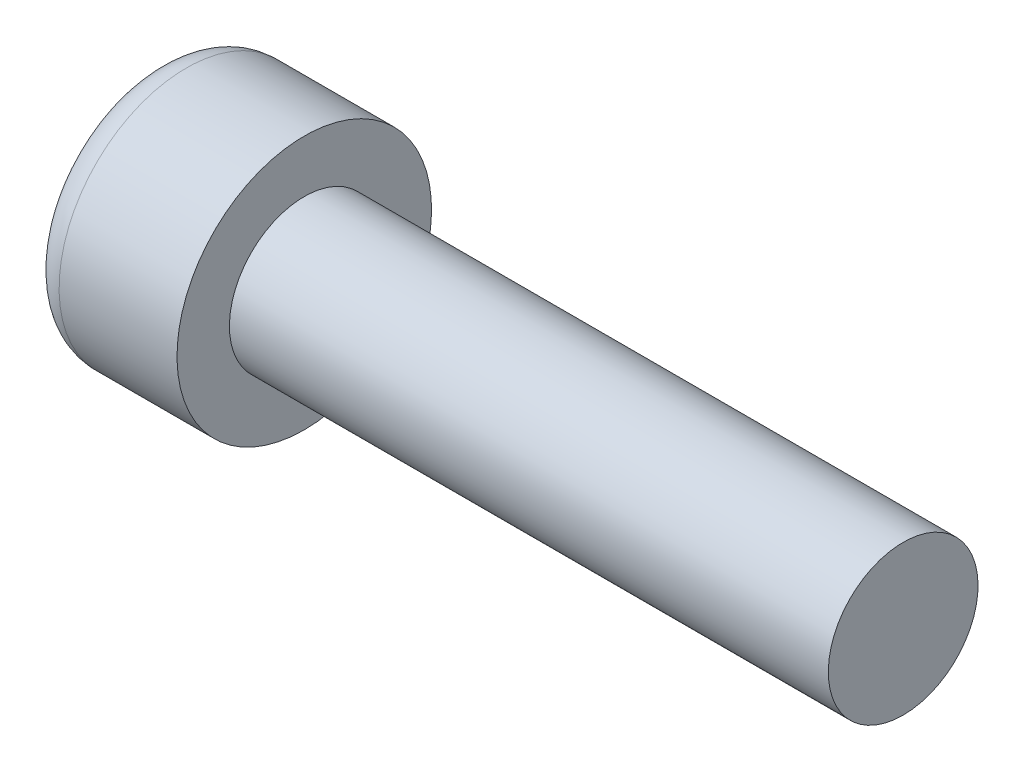
from build123d import *

# Parameters (mm, degrees)
CUT_EXTRUDE1_DEPTH = 2.5


with BuildPart() as part:
    # Sketch1 → Revolve1 (revolve)
    with BuildSketch(Plane.XY, mode=Mode.PRIVATE) as revolve1_sk:
        with BuildLine():
            Line((0, 0), (0, 3.1875))
            ThreePointArc((0, 3.1875), (0.311199045, 3.938800955), (1.0625, 4.25))
            Line((1.0625, 4.25), (5, 4.25))
            Line((5, 4.25), (5, 2.5))
            Line((5, 2.5), (25, 2.5))
            Line((25, 2.5), (25, 0))
            Line((25, 0), (0, 0))
        make_face()
    revolve(revolve1_sk.sketch.rotate(Axis((0, 0, 0), (1, 0, 0)), 180), axis=Axis((0, 0, 0), (1, 0, 0)))

    # Sketch2 → Cut-Extrude1 (cut)
    with BuildSketch(Plane.ZY):
        Polygon((0, 2.309401077), (-2, 1.154700538), (-2, -1.154700538), (0, -2.309401077), (2, -1.154700538), (2, 1.154700538), align=None)
    extrude(amount=-CUT_EXTRUDE1_DEPTH, mode=Mode.SUBTRACT)


solid = part.part
